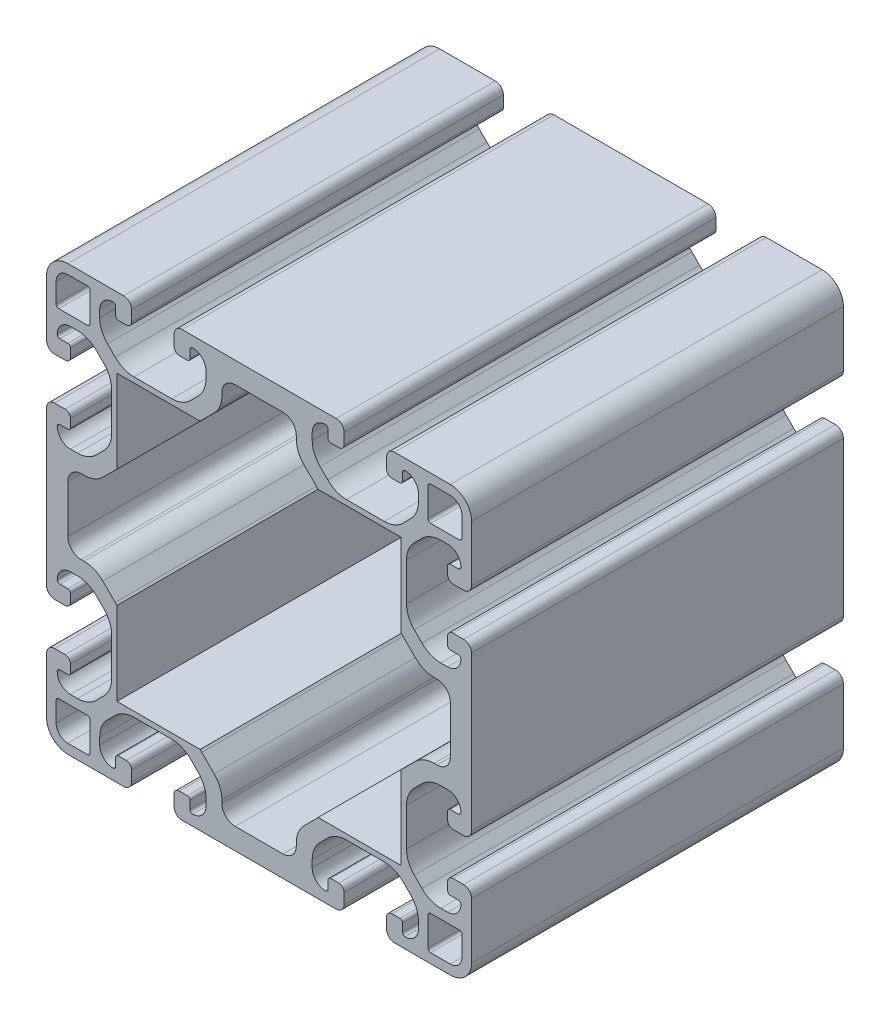
from build123d import *

# Parameters (mm, degrees)
ESQUISSE1_R             = 3.4
BOSS_EXTRU_1_DEPTH      = 70
ESQUISSE2_W             = 53.5
ESQUISSE2_H             = 53.5
ENL_V_MAT_EXTRU_1_DEPTH = 65


with BuildPart() as part:
    # Esquisse1 → Boss.-Extru.1 (new body)
    with BuildSketch(Plane(origin=(0, 0, -30), x_dir=(-1, 0, 0), z_dir=(0, 0, -1))):
        with BuildLine():
            Line((-4.5, 55), (-4.5, 53.5))
            ThreePointArc((-4.5, 53.5), (-4.353553391, 53.146446609), (-4, 53))
            Line((-4, 53), (-2.5, 53))
            ThreePointArc((-2.5, 53), (-2.146446609, 52.853553391), (-2, 52.5))
            ThreePointArc((-2, 52.5), (-2.732233047, 50.732233047), (-4.5, 50))
            Line((-4.5, 50), (-5.807611845, 50))
            ThreePointArc((-5.807611845, 50), (-7.721029006, 50.380602337), (-9.343145751, 51.464466094))
            Line((-9.343145751, 51.464466094), (-10.785533906, 52.906854249))
            ThreePointArc((-10.785533906, 52.906854249), (-11.869397663, 54.528970994), (-12.25, 56.442388155))
            Line((-12.25, 56.442388155), (-12.25, 63.557611845))
            ThreePointArc((-12.25, 63.557611845), (-11.869397663, 65.471029006), (-10.785533906, 67.093145751))
            Line((-10.785533906, 67.093145751), (-9.343145751, 68.535533906))
            ThreePointArc((-9.343145751, 68.535533906), (-7.721029006, 69.619397663), (-5.807611845, 70))
            Line((-5.807611845, 70), (-4.5, 70))
            ThreePointArc((-4.5, 70), (-2.732233047, 69.267766953), (-2, 67.5))
            ThreePointArc((-2, 67.5), (-2.146446609, 67.146446609), (-2.5, 67))
            Line((-2.5, 67), (-4, 67))
            ThreePointArc((-4, 67), (-4.353553391, 66.853553391), (-4.5, 66.5))
            Line((-4.5, 66.5), (-4.5, 65))
            ThreePointArc((-4.5, 65), (-4.207106781, 64.292893219), (-3.5, 64))
            Line((-3.5, 64), (-1.5, 64))
            ThreePointArc((-1.5, 64), (-0.439339828, 64.439339828), (0, 65.5))
            Line((0, 65.5), (0, 76))
            ThreePointArc((0, 76), (-1.171572875, 78.828427125), (-4, 80))
            Line((-4, 80), (-14.5, 80))
            ThreePointArc((-14.5, 80), (-15.560660172, 79.560660172), (-16, 78.5))
            Line((-16, 78.5), (-16, 76.5))
            ThreePointArc((-16, 76.5), (-15.707106781, 75.792893219), (-15, 75.5))
            Line((-15, 75.5), (-13.5, 75.5))
            ThreePointArc((-13.5, 75.5), (-13.146446609, 75.646446609), (-13, 76))
            Line((-13, 76), (-13, 77.5))
            ThreePointArc((-13, 77.5), (-12.853553391, 77.853553391), (-12.5, 78))
            ThreePointArc((-12.5, 78), (-10.732233047, 77.267766953), (-10, 75.5))
            Line((-10, 75.5), (-10, 74.192388155))
            ThreePointArc((-10, 74.192388155), (-10.380602337, 72.278970994), (-11.464466094, 70.656854249))
            Line((-11.464466094, 70.656854249), (-12.906854249, 69.214466094))
            ThreePointArc((-12.906854249, 69.214466094), (-14.528970994, 68.130602337), (-16.442388155, 67.75))
            Line((-16.442388155, 67.75), (-23.557611845, 67.75))
            ThreePointArc((-23.557611845, 67.75), (-25.471029006, 68.130602337), (-27.093145751, 69.214466094))
            Line((-27.093145751, 69.214466094), (-28.535533906, 70.656854249))
            ThreePointArc((-28.535533906, 70.656854249), (-29.619397663, 72.278970994), (-30, 74.192388155))
            Line((-30, 74.192388155), (-30, 75.5))
            ThreePointArc((-30, 75.5), (-29.267766953, 77.267766953), (-27.5, 78))
            ThreePointArc((-27.5, 78), (-27.146446609, 77.853553391), (-27, 77.5))
            Line((-27, 77.5), (-27, 76))
            ThreePointArc((-27, 76), (-26.853553391, 75.646446609), (-26.5, 75.5))
            Line((-26.5, 75.5), (-25, 75.5))
            ThreePointArc((-25, 75.5), (-24.292893219, 75.792893219), (-24, 76.5))
            Line((-24, 76.5), (-24, 78.5))
            ThreePointArc((-24, 78.5), (-24.439339828, 79.560660172), (-25.5, 80))
            Line((-25.5, 80), (-54.5, 80))
            ThreePointArc((-54.5, 80), (-55.560660172, 79.560660172), (-56, 78.5))
            Line((-56, 78.5), (-56, 76.5))
            ThreePointArc((-56, 76.5), (-55.707106781, 75.792893219), (-55, 75.5))
            Line((-55, 75.5), (-53.5, 75.5))
            ThreePointArc((-53.5, 75.5), (-53.146446609, 75.646446609), (-53, 76))
            Line((-53, 76), (-53, 77.5))
            ThreePointArc((-53, 77.5), (-52.853553391, 77.853553391), (-52.5, 78))
            ThreePointArc((-52.5, 78), (-50.732233047, 77.267766953), (-50, 75.5))
            Line((-50, 75.5), (-50, 74.192388155))
            ThreePointArc((-50, 74.192388155), (-50.380602337, 72.278970994), (-51.464466094, 70.656854249))
            Line((-51.464466094, 70.656854249), (-52.906854249, 69.214466094))
            ThreePointArc((-52.906854249, 69.214466094), (-54.528970994, 68.130602337), (-56.442388155, 67.75))
            Line((-56.442388155, 67.75), (-63.557611845, 67.75))
            ThreePointArc((-63.557611845, 67.75), (-65.471029006, 68.130602337), (-67.093145751, 69.214466094))
            Line((-67.093145751, 69.214466094), (-68.535533906, 70.656854249))
            ThreePointArc((-68.535533906, 70.656854249), (-69.619397663, 72.278970994), (-70, 74.192388155))
            Line((-70, 74.192388155), (-70, 75.5))
            ThreePointArc((-70, 75.5), (-69.267766953, 77.267766953), (-67.5, 78))
            ThreePointArc((-67.5, 78), (-67.146446609, 77.853553391), (-67, 77.5))
            Line((-67, 77.5), (-67, 76))
            ThreePointArc((-67, 76), (-66.853553391, 75.646446609), (-66.5, 75.5))
            Line((-66.5, 75.5), (-65, 75.5))
            ThreePointArc((-65, 75.5), (-64.292893219, 75.792893219), (-64, 76.5))
            Line((-64, 76.5), (-64, 78.5))
            ThreePointArc((-64, 78.5), (-64.439339828, 79.560660172), (-65.5, 80))
            Line((-65.5, 80), (-76, 80))
            ThreePointArc((-76, 80), (-78.828427125, 78.828427125), (-80, 76))
            Line((-80, 76), (-80, 65.5))
            ThreePointArc((-80, 65.5), (-79.560660172, 64.439339828), (-78.5, 64))
            Line((-78.5, 64), (-76.5, 64))
            ThreePointArc((-76.5, 64), (-75.792893219, 64.292893219), (-75.5, 65))
            Line((-75.5, 65), (-75.5, 66.5))
            ThreePointArc((-75.5, 66.5), (-75.646446609, 66.853553391), (-76, 67))
            Line((-76, 67), (-77.5, 67))
            ThreePointArc((-77.5, 67), (-77.853553391, 67.146446609), (-78, 67.5))
            ThreePointArc((-78, 67.5), (-77.267766953, 69.267766953), (-75.5, 70))
            Line((-75.5, 70), (-74.192388155, 70))
            ThreePointArc((-74.192388155, 70), (-72.278970994, 69.619397663), (-70.656854249, 68.535533906))
            Line((-70.656854249, 68.535533906), (-69.214466094, 67.093145751))
            ThreePointArc((-69.214466094, 67.093145751), (-68.130602337, 65.471029006), (-67.75, 63.557611845))
            Line((-67.75, 63.557611845), (-67.75, 56.442388155))
            ThreePointArc((-67.75, 56.442388155), (-68.130602337, 54.528970994), (-69.214466094, 52.906854249))
            Line((-69.214466094, 52.906854249), (-70.656854249, 51.464466094))
            ThreePointArc((-70.656854249, 51.464466094), (-72.278970994, 50.380602337), (-74.192388155, 50))
            Line((-74.192388155, 50), (-75.5, 50))
            ThreePointArc((-75.5, 50), (-77.267766953, 50.732233047), (-78, 52.5))
            ThreePointArc((-78, 52.5), (-77.853553391, 52.853553391), (-77.5, 53))
            Line((-77.5, 53), (-76, 53))
            ThreePointArc((-76, 53), (-75.646446609, 53.146446609), (-75.5, 53.5))
            Line((-75.5, 53.5), (-75.5, 55))
            ThreePointArc((-75.5, 55), (-75.792893219, 55.707106781), (-76.5, 56))
            Line((-76.5, 56), (-78.5, 56))
            ThreePointArc((-78.5, 56), (-79.560660172, 55.560660172), (-80, 54.5))
            Line((-80, 54.5), (-80, 25.5))
            ThreePointArc((-80, 25.5), (-79.560660172, 24.439339828), (-78.5, 24))
            Line((-78.5, 24), (-76.5, 24))
            ThreePointArc((-76.5, 24), (-75.792893219, 24.292893219), (-75.5, 25))
            Line((-75.5, 25), (-75.5, 26.5))
            ThreePointArc((-75.5, 26.5), (-75.646446609, 26.853553391), (-76, 27))
            Line((-76, 27), (-77.5, 27))
            ThreePointArc((-77.5, 27), (-77.853553391, 27.146446609), (-78, 27.5))
            ThreePointArc((-78, 27.5), (-77.267766953, 29.267766953), (-75.5, 30))
            Line((-75.5, 30), (-74.192388155, 30))
            ThreePointArc((-74.192388155, 30), (-72.278970994, 29.619397663), (-70.656854249, 28.535533906))
            Line((-70.656854249, 28.535533906), (-69.214466094, 27.093145751))
            ThreePointArc((-69.214466094, 27.093145751), (-68.130602337, 25.471029006), (-67.75, 23.557611845))
            Line((-67.75, 23.557611845), (-67.75, 16.442388155))
            ThreePointArc((-67.75, 16.442388155), (-68.130602337, 14.528970994), (-69.214466094, 12.906854249))
            Line((-69.214466094, 12.906854249), (-70.656854249, 11.464466094))
            ThreePointArc((-70.656854249, 11.464466094), (-72.278970994, 10.380602337), (-74.192388155, 10))
            Line((-74.192388155, 10), (-75.5, 10))
            ThreePointArc((-75.5, 10), (-77.267766953, 10.732233047), (-78, 12.5))
            ThreePointArc((-78, 12.5), (-77.853553391, 12.853553391), (-77.5, 13))
            Line((-77.5, 13), (-76, 13))
            ThreePointArc((-76, 13), (-75.646446609, 13.146446609), (-75.5, 13.5))
            Line((-75.5, 13.5), (-75.5, 15))
            ThreePointArc((-75.5, 15), (-75.792893219, 15.707106781), (-76.5, 16))
            Line((-76.5, 16), (-78.5, 16))
            ThreePointArc((-78.5, 16), (-79.560660172, 15.560660172), (-80, 14.5))
            Line((-80, 14.5), (-80, 4))
            ThreePointArc((-80, 4), (-78.828427125, 1.171572875), (-76, 0))
            Line((-76, 0), (-65.5, 0))
            ThreePointArc((-65.5, 0), (-64.439339828, 0.439339828), (-64, 1.5))
            Line((-64, 1.5), (-64, 3.5))
            ThreePointArc((-64, 3.5), (-64.292893219, 4.207106781), (-65, 4.5))
            Line((-65, 4.5), (-66.5, 4.5))
            ThreePointArc((-66.5, 4.5), (-66.853553391, 4.353553391), (-67, 4))
            Line((-67, 4), (-67, 2.5))
            ThreePointArc((-67, 2.5), (-67.146446609, 2.146446609), (-67.5, 2))
            ThreePointArc((-67.5, 2), (-69.267766953, 2.732233047), (-70, 4.5))
            Line((-70, 4.5), (-70, 5.807611845))
            ThreePointArc((-70, 5.807611845), (-69.619397663, 7.721029006), (-68.535533906, 9.343145751))
            Line((-68.535533906, 9.343145751), (-67.093145751, 10.785533906))
            ThreePointArc((-67.093145751, 10.785533906), (-65.471029006, 11.869397663), (-63.557611845, 12.25))
            Line((-63.557611845, 12.25), (-56.442388155, 12.25))
            ThreePointArc((-56.442388155, 12.25), (-54.528970994, 11.869397663), (-52.906854249, 10.785533906))
            Line((-52.906854249, 10.785533906), (-51.464466094, 9.343145751))
            ThreePointArc((-51.464466094, 9.343145751), (-50.380602337, 7.721029006), (-50, 5.807611845))
            Line((-50, 5.807611845), (-50, 4.5))
            ThreePointArc((-50, 4.5), (-50.732233047, 2.732233047), (-52.5, 2))
            ThreePointArc((-52.5, 2), (-52.853553391, 2.146446609), (-53, 2.5))
            Line((-53, 2.5), (-53, 4))
            ThreePointArc((-53, 4), (-53.146446609, 4.353553391), (-53.5, 4.5))
            Line((-53.5, 4.5), (-55, 4.5))
            ThreePointArc((-55, 4.5), (-55.707106781, 4.207106781), (-56, 3.5))
            Line((-56, 3.5), (-56, 1.5))
            ThreePointArc((-56, 1.5), (-55.560660172, 0.439339828), (-54.5, 0))
            Line((-54.5, 0), (-25.5, 0))
            ThreePointArc((-25.5, 0), (-24.439339828, 0.439339828), (-24, 1.5))
            Line((-24, 1.5), (-24, 3.5))
            ThreePointArc((-24, 3.5), (-24.292893219, 4.207106781), (-25, 4.5))
            Line((-25, 4.5), (-26.5, 4.5))
            ThreePointArc((-26.5, 4.5), (-26.853553391, 4.353553391), (-27, 4))
            Line((-27, 4), (-27, 2.5))
            ThreePointArc((-27, 2.5), (-27.146446609, 2.146446609), (-27.5, 2))
            ThreePointArc((-27.5, 2), (-29.267766953, 2.732233047), (-30, 4.5))
            Line((-30, 4.5), (-30, 5.807611845))
            ThreePointArc((-30, 5.807611845), (-29.619397663, 7.721029006), (-28.535533906, 9.343145751))
            Line((-28.535533906, 9.343145751), (-27.093145751, 10.785533906))
            ThreePointArc((-27.093145751, 10.785533906), (-25.471029006, 11.869397663), (-23.557611845, 12.25))
            Line((-23.557611845, 12.25), (-16.442388155, 12.25))
            ThreePointArc((-16.442388155, 12.25), (-14.528970994, 11.869397663), (-12.906854249, 10.785533906))
            Line((-12.906854249, 10.785533906), (-11.464466094, 9.343145751))
            ThreePointArc((-11.464466094, 9.343145751), (-10.380602337, 7.721029006), (-10, 5.807611845))
            Line((-10, 5.807611845), (-10, 4.5))
            ThreePointArc((-10, 4.5), (-10.732233047, 2.732233047), (-12.5, 2))
            ThreePointArc((-12.5, 2), (-12.853553391, 2.146446609), (-13, 2.5))
            Line((-13, 2.5), (-13, 4))
            ThreePointArc((-13, 4), (-13.146446609, 4.353553391), (-13.5, 4.5))
            Line((-13.5, 4.5), (-15, 4.5))
            ThreePointArc((-15, 4.5), (-15.707106781, 4.207106781), (-16, 3.5))
            Line((-16, 3.5), (-16, 1.5))
            ThreePointArc((-16, 1.5), (-15.560660172, 0.439339828), (-14.5, 0))
            Line((-14.5, 0), (-4, 0))
            ThreePointArc((-4, 0), (-1.171572875, 1.171572875), (0, 4))
            Line((0, 4), (0, 14.5))
            ThreePointArc((0, 14.5), (-0.439339828, 15.560660172), (-1.5, 16))
            Line((-1.5, 16), (-3.5, 16))
            ThreePointArc((-3.5, 16), (-4.207106781, 15.707106781), (-4.5, 15))
            Line((-4.5, 15), (-4.5, 13.5))
            ThreePointArc((-4.5, 13.5), (-4.353553391, 13.146446609), (-4, 13))
            Line((-4, 13), (-2.5, 13))
            ThreePointArc((-2.5, 13), (-2.146446609, 12.853553391), (-2, 12.5))
            ThreePointArc((-2, 12.5), (-2.732233047, 10.732233047), (-4.5, 10))
            Line((-4.5, 10), (-5.807611845, 10))
            ThreePointArc((-5.807611845, 10), (-7.721029006, 10.380602337), (-9.343145751, 11.464466094))
            Line((-9.343145751, 11.464466094), (-10.785533906, 12.906854249))
            ThreePointArc((-10.785533906, 12.906854249), (-11.869397663, 14.528970994), (-12.25, 16.442388155))
            Line((-12.25, 16.442388155), (-12.25, 23.557611845))
            ThreePointArc((-12.25, 23.557611845), (-11.869397663, 25.471029006), (-10.785533906, 27.093145751))
            Line((-10.785533906, 27.093145751), (-9.343145751, 28.535533906))
            ThreePointArc((-9.343145751, 28.535533906), (-7.721029006, 29.619397663), (-5.807611845, 30))
            Line((-5.807611845, 30), (-4.5, 30))
            ThreePointArc((-4.5, 30), (-2.732233047, 29.267766953), (-2, 27.5))
            ThreePointArc((-2, 27.5), (-2.146446609, 27.146446609), (-2.5, 27))
            Line((-2.5, 27), (-4, 27))
            ThreePointArc((-4, 27), (-4.353553391, 26.853553391), (-4.5, 26.5))
            Line((-4.5, 26.5), (-4.5, 25))
            ThreePointArc((-4.5, 25), (-4.207106781, 24.292893219), (-3.5, 24))
            Line((-3.5, 24), (-1.5, 24))
            ThreePointArc((-1.5, 24), (-0.439339828, 24.439339828), (0, 25.5))
            Line((0, 25.5), (0, 54.5))
            ThreePointArc((0, 54.5), (-0.439339828, 55.560660172), (-1.5, 56))
            Line((-1.5, 56), (-3.5, 56))
            ThreePointArc((-3.5, 56), (-4.207106781, 55.707106781), (-4.5, 55))
        make_face()
        with Locations(Location((-20, 20, 0), (0, 0, 180))):
            Circle(ESQUISSE1_R, mode=Mode.SUBTRACT)
        with Locations(Location((-20, 60, 0), (0, 0, 180))):
            Circle(ESQUISSE1_R, mode=Mode.SUBTRACT)
        with Locations(Location((-60, 20, 0), (0, 0, 180))):
            Circle(ESQUISSE1_R, mode=Mode.SUBTRACT)
        with Locations(Location((-60, 60, 0), (0, 0, 180))):
            Circle(ESQUISSE1_R, mode=Mode.SUBTRACT)
        with BuildLine():
            Line((-24.112175362, 27.603553391), (-27.603553391, 24.112175362))
            ThreePointArc((-27.603553391, 24.112175362), (-27.711939766, 23.949963688), (-27.75, 23.758621971))
            Line((-27.75, 23.758621971), (-27.75, 16.442388155))
            ThreePointArc((-27.75, 16.442388155), (-28.130602337, 14.528970994), (-29.214466094, 12.906854249))
            Line((-29.214466094, 12.906854249), (-31.535533906, 10.585786438))
            ThreePointArc((-31.535533906, 10.585786438), (-32.619397663, 8.963669694), (-33, 7.050252532))
            Line((-33, 7.050252532), (-33, 6.5))
            ThreePointArc((-33, 6.5), (-33.732233047, 4.732233047), (-35.5, 4))
            Line((-35.5, 4), (-44.5, 4))
            ThreePointArc((-44.5, 4), (-46.267766953, 4.732233047), (-47, 6.5))
            Line((-47, 6.5), (-47, 7.050252532))
            ThreePointArc((-47, 7.050252532), (-47.380602337, 8.963669694), (-48.464466094, 10.585786438))
            Line((-48.464466094, 10.585786438), (-50.785533906, 12.906854249))
            ThreePointArc((-50.785533906, 12.906854249), (-51.869397663, 14.528970994), (-52.25, 16.442388155))
            Line((-52.25, 16.442388155), (-52.25, 23.758621971))
            ThreePointArc((-52.25, 23.758621971), (-52.288060234, 23.949963688), (-52.396446609, 24.112175362))
            Line((-52.396446609, 24.112175362), (-55.887824638, 27.603553391))
            ThreePointArc((-55.887824638, 27.603553391), (-56.050036312, 27.711939766), (-56.241378029, 27.75))
            Line((-56.241378029, 27.75), (-63.557611845, 27.75))
            ThreePointArc((-63.557611845, 27.75), (-65.471029006, 28.130602337), (-67.09314575, 29.214466094))
            Line((-67.09314575, 29.214466094), (-69.414213562, 31.535533906))
            ThreePointArc((-69.414213562, 31.535533906), (-71.036330306, 32.619397663), (-72.949747468, 33))
            Line((-72.949747468, 33), (-73.5, 33))
            ThreePointArc((-73.5, 33), (-75.267766953, 33.732233047), (-76, 35.5))
            Line((-76, 35.5), (-76, 44.5))
            ThreePointArc((-76, 44.5), (-75.267766953, 46.267766953), (-73.5, 47))
            Line((-73.5, 47), (-72.949747468, 47))
            ThreePointArc((-72.949747468, 47), (-71.036330306, 47.380602337), (-69.414213562, 48.464466094))
            Line((-69.414213562, 48.464466094), (-67.09314575, 50.785533906))
            ThreePointArc((-67.09314575, 50.785533906), (-65.471029006, 51.869397663), (-63.557611845, 52.25))
            Line((-63.557611845, 52.25), (-56.241378029, 52.25))
            ThreePointArc((-56.241378029, 52.25), (-56.050036312, 52.288060234), (-55.887824638, 52.396446609))
            Line((-55.887824638, 52.396446609), (-52.396446609, 55.887824638))
            ThreePointArc((-52.396446609, 55.887824638), (-52.288060234, 56.050036312), (-52.25, 56.241378029))
            Line((-52.25, 56.241378029), (-52.25, 63.557611845))
            ThreePointArc((-52.25, 63.557611845), (-51.869397663, 65.471029006), (-50.785533906, 67.09314575))
            Line((-50.785533906, 67.09314575), (-48.464466094, 69.414213562))
            ThreePointArc((-48.464466094, 69.414213562), (-47.380602337, 71.036330306), (-47, 72.949747468))
            Line((-47, 72.949747468), (-47, 73.5))
            ThreePointArc((-47, 73.5), (-46.267766953, 75.267766953), (-44.5, 76))
            Line((-44.5, 76), (-35.5, 76))
            ThreePointArc((-35.5, 76), (-33.732233047, 75.267766953), (-33, 73.5))
            Line((-33, 73.5), (-33, 72.949747468))
            ThreePointArc((-33, 72.949747468), (-32.619397663, 71.036330306), (-31.535533906, 69.414213562))
            Line((-31.535533906, 69.414213562), (-29.214466094, 67.09314575))
            ThreePointArc((-29.214466094, 67.09314575), (-28.130602337, 65.471029006), (-27.75, 63.557611845))
            Line((-27.75, 63.557611845), (-27.75, 56.241378029))
            ThreePointArc((-27.75, 56.241378029), (-27.711939766, 56.050036312), (-27.603553391, 55.887824638))
            Line((-27.603553391, 55.887824638), (-24.112175362, 52.396446609))
            ThreePointArc((-24.112175362, 52.396446609), (-23.949963688, 52.288060234), (-23.758621971, 52.25))
            Line((-23.758621971, 52.25), (-16.442388155, 52.25))
            ThreePointArc((-16.442388155, 52.25), (-14.528970994, 51.869397663), (-12.906854249, 50.785533906))
            Line((-12.906854249, 50.785533906), (-10.585786438, 48.464466094))
            ThreePointArc((-10.585786438, 48.464466094), (-8.963669694, 47.380602337), (-7.050252532, 47))
            Line((-7.050252532, 47), (-6.5, 47))
            ThreePointArc((-6.5, 47), (-4.732233047, 46.267766953), (-4, 44.5))
            Line((-4, 44.5), (-4, 35.5))
            ThreePointArc((-4, 35.5), (-4.73303314, 33.73303314), (-6.5, 33))
            Line((-6.5, 33), (-7.050252532, 33))
            ThreePointArc((-7.050252532, 33), (-8.963669694, 32.619397663), (-10.585786438, 31.535533906))
            Line((-10.585786438, 31.535533906), (-12.906854249, 29.214466094))
            ThreePointArc((-12.906854249, 29.214466094), (-14.528970994, 28.130602337), (-16.442388155, 27.75))
            Line((-16.442388155, 27.75), (-23.758621971, 27.75))
            ThreePointArc((-23.758621971, 27.75), (-23.949963688, 27.711939766), (-24.112175362, 27.603553391))
        make_face(mode=Mode.SUBTRACT)
        with BuildLine():
            Line((-4, 1.8), (-7.7, 1.8))
            ThreePointArc((-7.7, 1.8), (-8.053553391, 1.946446609), (-8.2, 2.3))
            Line((-8.2, 2.3), (-8.2, 7.7))
            ThreePointArc((-8.2, 7.7), (-8.053553391, 8.053553391), (-7.7, 8.2))
            Line((-7.7, 8.2), (-2.3, 8.2))
            ThreePointArc((-2.3, 8.2), (-1.946446609, 8.053553391), (-1.8, 7.7))
            Line((-1.8, 7.7), (-1.8, 4))
            ThreePointArc((-1.8, 4), (-2.444365081, 2.444365081), (-4, 1.8))
        make_face(mode=Mode.SUBTRACT)
        with BuildLine():
            Line((-78.2, 4), (-78.2, 7.7))
            ThreePointArc((-78.2, 7.7), (-78.053553391, 8.053553391), (-77.7, 8.2))
            Line((-77.7, 8.2), (-72.3, 8.2))
            ThreePointArc((-72.3, 8.2), (-71.946446609, 8.053553391), (-71.8, 7.7))
            Line((-71.8, 7.7), (-71.8, 2.3))
            ThreePointArc((-71.8, 2.3), (-71.946446609, 1.946446609), (-72.3, 1.8))
            Line((-72.3, 1.8), (-76, 1.8))
            ThreePointArc((-76, 1.8), (-77.555634919, 2.444365081), (-78.2, 4))
        make_face(mode=Mode.SUBTRACT)
        with BuildLine():
            Line((-76, 78.2), (-72.3, 78.2))
            ThreePointArc((-72.3, 78.2), (-71.946446609, 78.053553391), (-71.8, 77.7))
            Line((-71.8, 77.7), (-71.8, 72.3))
            ThreePointArc((-71.8, 72.3), (-71.946446609, 71.946446609), (-72.3, 71.8))
            Line((-72.3, 71.8), (-77.7, 71.8))
            ThreePointArc((-77.7, 71.8), (-78.053553391, 71.946446609), (-78.2, 72.3))
            Line((-78.2, 72.3), (-78.2, 76))
            ThreePointArc((-78.2, 76), (-77.555634919, 77.555634919), (-76, 78.2))
        make_face(mode=Mode.SUBTRACT)
        with BuildLine():
            Line((-1.8, 76), (-1.8, 72.3))
            ThreePointArc((-1.8, 72.3), (-1.946446609, 71.946446609), (-2.3, 71.8))
            Line((-2.3, 71.8), (-7.7, 71.8))
            ThreePointArc((-7.7, 71.8), (-8.053553391, 71.946446609), (-8.2, 72.3))
            Line((-8.2, 72.3), (-8.2, 77.7))
            ThreePointArc((-8.2, 77.7), (-8.053553391, 78.053553391), (-7.7, 78.2))
            Line((-7.7, 78.2), (-4, 78.2))
            ThreePointArc((-4, 78.2), (-2.444365081, 77.555634919), (-1.8, 76))
        make_face(mode=Mode.SUBTRACT)
    extrude(amount=-BOSS_EXTRU_1_DEPTH)

    # Esquisse2 → Enlèv. mat.-Extru.1 (cut)
    with BuildSketch(Plane.XY.offset(40)):
        with Locations((40, 40)):
            Rectangle(ESQUISSE2_W, ESQUISSE2_H)
    extrude(amount=-ENL_V_MAT_EXTRU_1_DEPTH, mode=Mode.SUBTRACT)


solid = part.part
